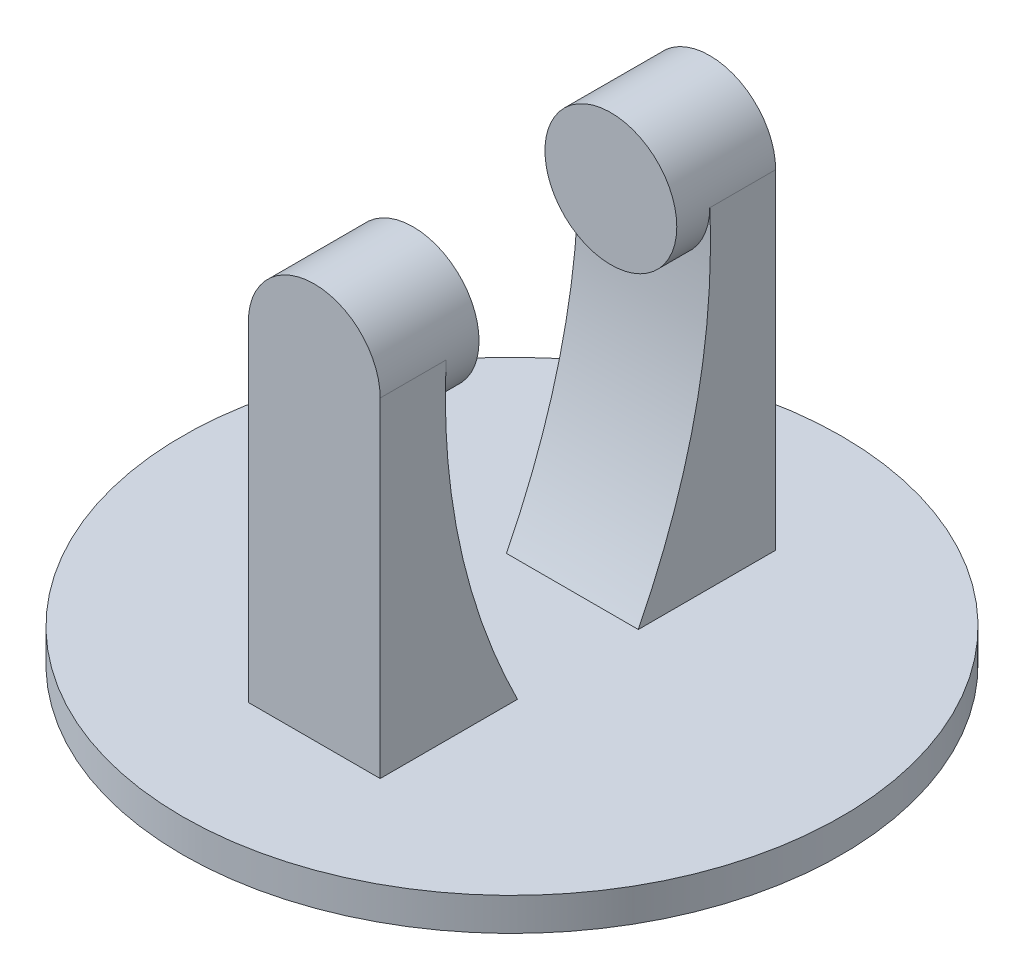
from build123d import *

# Parameters (mm, degrees)
SKETCH2_R                = 50
BOSS_EXTRUDE1_DEPTH      = 5
SKETCH3_W                = 60
SKETCH3_H                = 60
BOSS_EXTRUDE2_DEPTH      = 60
CUT_EXTRUDE14_DEPTH      = 150
CUT_EXTRUDE15_DEPTH      = 150
CUT_EXTRUDE16_DEPTH      = 71
CUT_EXTRUDE16_DEPTH_BACK = 56
SKETCH31_R               = 10
BOSS_EXTRUDE5_DEPTH      = 5
BOSS_EXTRUDE6_START      = 5
SKETCH32_R               = 10
BOSS_EXTRUDE6_DEPTH      = 5


with BuildPart() as part:
    # Sketch2 → Boss-Extrude1 (new body)
    with BuildSketch(Plane(origin=(0, 0, 0), x_dir=(1, 0, 0), z_dir=(0, 1, 0))):
        with Locations(Location((0, 0, 0), (0, 0, 270))):
            Circle(SKETCH2_R)
    extrude(amount=BOSS_EXTRUDE1_DEPTH)

    # Sketch3 → Boss-Extrude2 (add)
    with BuildSketch(Plane(origin=(0, 5, 0), x_dir=(1, 0, 0), z_dir=(0, 1, 0))):
        Rectangle(SKETCH3_W, SKETCH3_H)
    extrude(amount=BOSS_EXTRUDE2_DEPTH)

    # Sketch19 → Cut-Extrude14 (cut)
    with BuildSketch(Plane.XY.offset(30)):
        with BuildLine():
            Line((-10, 5), (-10, 55))
            ThreePointArc((-10, 55), (-7.071067812, 62.071067812), (0, 65))
            Line((0, 65), (-30, 65))
            Line((-30, 65), (-30, 5))
            Line((-30, 5), (-10, 5))
        make_face()
    extrude(amount=-CUT_EXTRUDE14_DEPTH, mode=Mode.SUBTRACT)

    # Sketch29 → Cut-Extrude15 (cut)
    with BuildSketch(Plane.XY.offset(30)):
        with BuildLine():
            Line((30, 65), (0, 65))
            ThreePointArc((0, 65), (7.071067812, 62.071067812), (10, 55))
            Line((10, 55), (10, 5))
            Line((10, 5), (30, 5))
            Line((30, 5), (30, 65))
        make_face()
    extrude(amount=-CUT_EXTRUDE15_DEPTH, mode=Mode.SUBTRACT)

    # Sketch30 → Cut-Extrude16 (cut, two sides: drawn at the far end of the back side and taken through both)
    with BuildSketch(Plane(origin=(0, 0, 0), x_dir=(0, 0, -1), z_dir=(1, 0, 0)).offset(-CUT_EXTRUDE16_DEPTH_BACK)):
        with BuildLine():
            Line((20, 65), (-20, 65))
            Line((-20, 65), (-20, 55))
            add(Edge.make_bspline(
                [(-20, 55), (-21.218129455, 29.129128635), (-9.16621621, 5)],
                knots=[0, 0, 0, 1, 1, 1], degree=2))
            Line((-9.16621621, 5), (9.16621621, 5))
            add(Edge.make_bspline(
                [(20, 55), (21.218129455, 29.129128635), (9.16621621, 5)],
                knots=[0, 0, 0, 1, 1, 1], degree=2))
            Line((20, 55), (20, 65))
        make_face()
    extrude(amount=CUT_EXTRUDE16_DEPTH + CUT_EXTRUDE16_DEPTH_BACK, mode=Mode.SUBTRACT)

    # Sketch31 → Boss-Extrude5 (add)
    with BuildSketch(Plane(origin=(0, 0, 20), x_dir=(-1, 0, 0), z_dir=(0, 0, -1))):
        with Locations(Location((0, 55, 0), (0, 0, 180))):
            Circle(SKETCH31_R)
    extrude(amount=BOSS_EXTRUDE5_DEPTH)

    # Sketch32 → Boss-Extrude6 (add)
    with BuildSketch(Plane.XY.offset(-20).offset(BOSS_EXTRUDE6_START)):
        with Locations((0, 55)):
            Circle(SKETCH32_R)
    extrude(amount=-BOSS_EXTRUDE6_DEPTH)


solid = part.part
